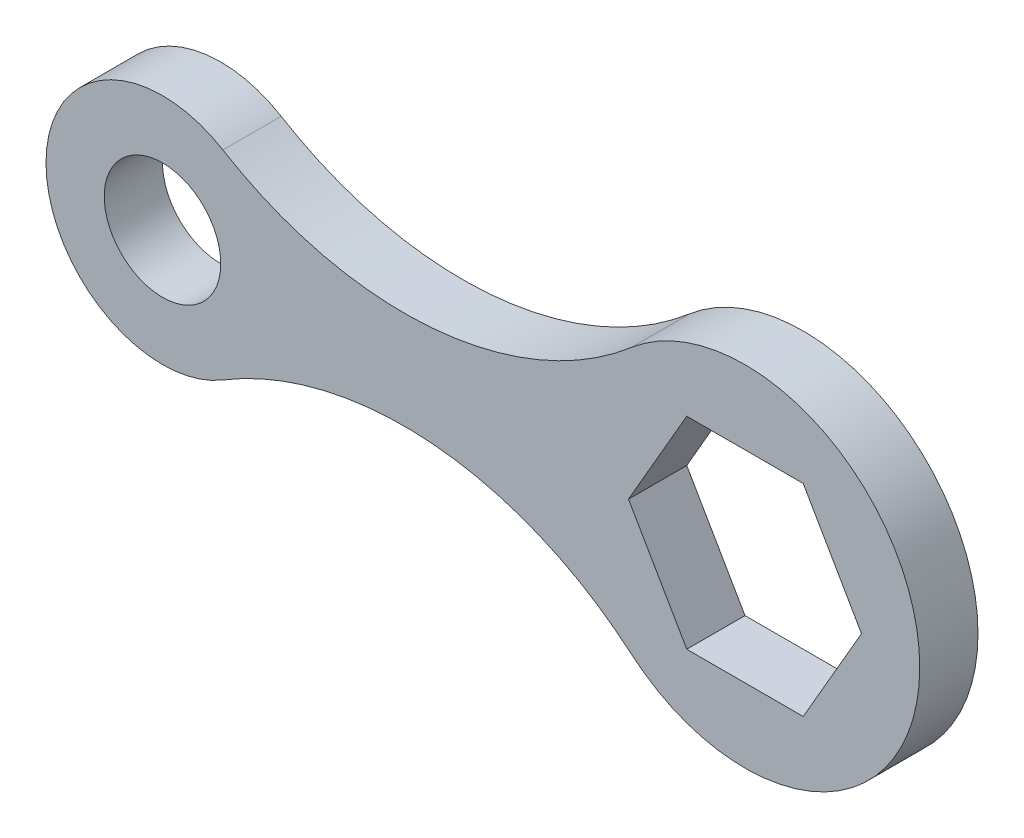
from build123d import *

# Parameters (mm, degrees)
SKETCH1_R           = 10
BOSS_EXTRUDE1_DEPTH = 5


with BuildPart() as part:
    # Sketch1 → Boss-Extrude1 (new, symmetric)
    with BuildSketch(Plane.XY):
        with BuildLine():
            ThreePointArc((-19.5, -22.79802623), (30, 0), (-19.5, 22.79802623))
            ThreePointArc((-19.5, 22.79802623), (-53.639444476, 8.591277753), (-89.625, 17.098519673))
            ThreePointArc((-89.625, 17.098519673), (-120, 0), (-89.625, -17.098519673))
            ThreePointArc((-89.625, -17.098519673), (-53.639444476, -8.591277753), (-19.5, -22.79802623))
        make_face()
        with Locations((-100, 0)):
            Circle(SKETCH1_R, mode=Mode.SUBTRACT)
        Polygon((-20, 0), (-10, -17.320508076), (10, -17.320508076), (20, 0), (10, 17.320508076), (-10, 17.320508076), align=None, mode=Mode.SUBTRACT)
    extrude(amount=BOSS_EXTRUDE1_DEPTH, both=True)


solid = part.part
